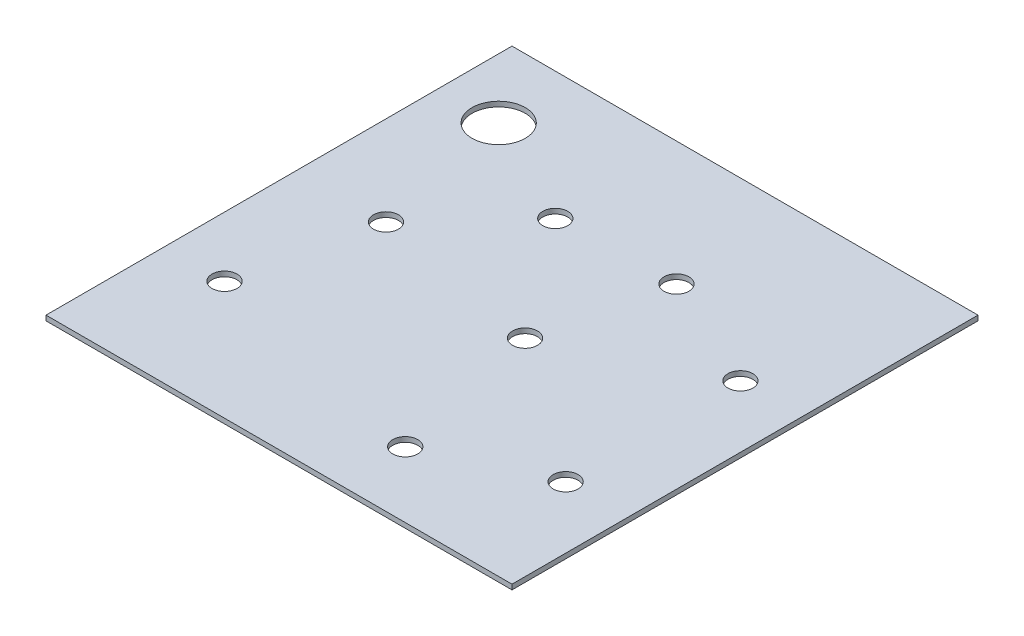
from build123d import *

# Parameters (mm, degrees)
SKETCH1_W           = 280
SKETCH1_H           = 280
SKETCH1_R           = 16
SKETCH1_R_2         = 7.5
BOSS_EXTRUDE1_DEPTH = 1.5


with BuildPart() as part:
    # Sketch1 → Boss-Extrude1 (new, symmetric)
    with BuildSketch(Plane(origin=(0, 0, 0), x_dir=(1, 0, 0), z_dir=(0, 1, 0))):
        Rectangle(SKETCH1_W, SKETCH1_H)
        with Locations(Location((-104, 96, 0), (0, 0, 270))):
            Circle(SKETCH1_R, mode=Mode.SUBTRACT)
        with Locations(Location((-86.345504448, 10.630092509, 0), (0, 0, 270))):
            Circle(SKETCH1_R_2, mode=Mode.SUBTRACT)
        with Locations(Location((-104, -68.745612269, 0), (0, 0, 270))):
            Circle(SKETCH1_R_2, mode=Mode.SUBTRACT)
        with Locations(Location((36.424311308, -100.557665157, 0), (0, 0, 270))):
            Circle(SKETCH1_R_2, mode=Mode.SUBTRACT)
        with Locations(Location((15.885461628, -8.055627876, 0), (0, 0, 270))):
            Circle(SKETCH1_R_2, mode=Mode.SUBTRACT)
        with Locations(Location((33.226728938, 65.584702367, 0), (0, 0, 270))):
            Circle(SKETCH1_R_2, mode=Mode.SUBTRACT)
        with Locations(Location((102.828111025, 34.411918454, 0), (0, 0, 270))):
            Circle(SKETCH1_R_2, mode=Mode.SUBTRACT)
        with Locations(Location((102.828111025, -70.598741563, 0), (0, 0, 270))):
            Circle(SKETCH1_R_2, mode=Mode.SUBTRACT)
        with Locations(Location((-37.296051937, 63.289287086, 0), (0, 0, 270))):
            Circle(SKETCH1_R_2, mode=Mode.SUBTRACT)
    extrude(amount=BOSS_EXTRUDE1_DEPTH, both=True)


solid = part.part
